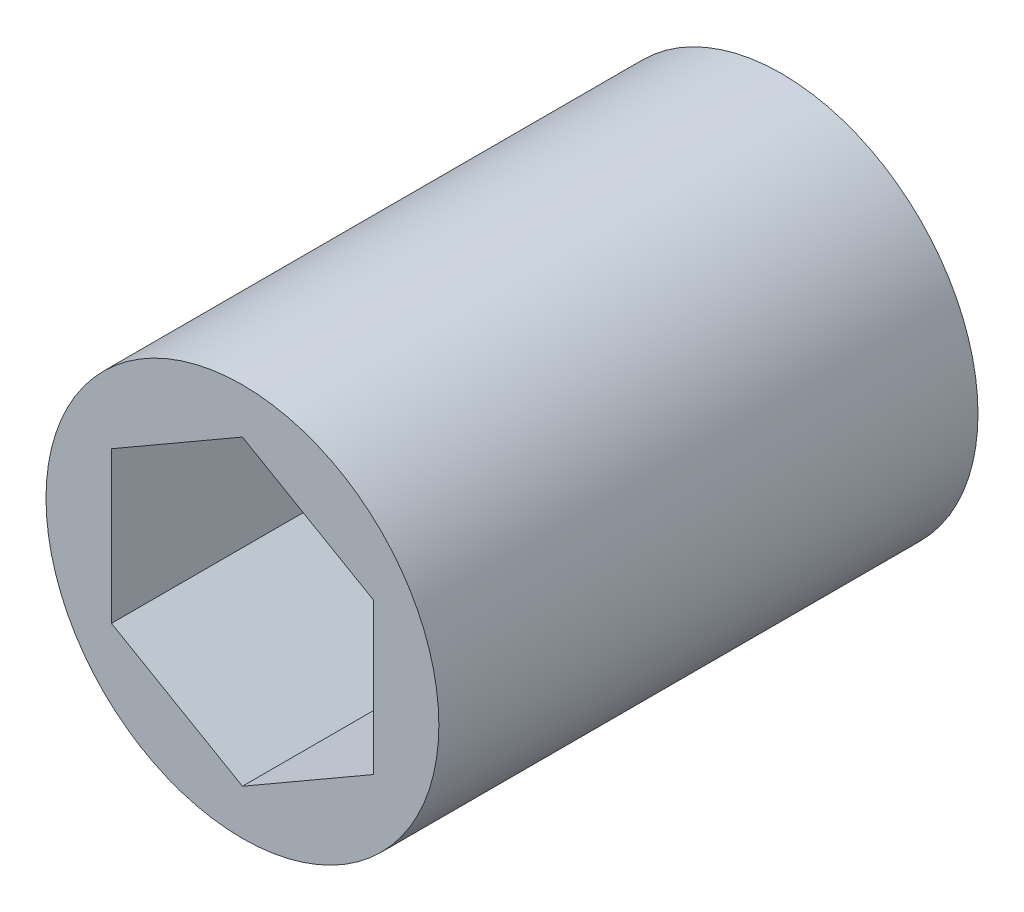
from build123d import *

# Parameters (mm, degrees)
SKETCH1_R           = 9.525
BOSS_EXTRUDE1_DEPTH = 13.072237


with BuildPart() as part:
    # Sketch1 → Boss-Extrude1 (new, symmetric)
    with BuildSketch(Plane.XY):
        Circle(SKETCH1_R)
        Polygon((0, 7.332348419), (-6.35, 3.666174209), (-6.35, -3.666174209), (0, -7.332348419), (6.35, -3.666174209), (6.35, 3.666174209), align=None, mode=Mode.SUBTRACT)
    extrude(amount=BOSS_EXTRUDE1_DEPTH, both=True)


solid = part.part
